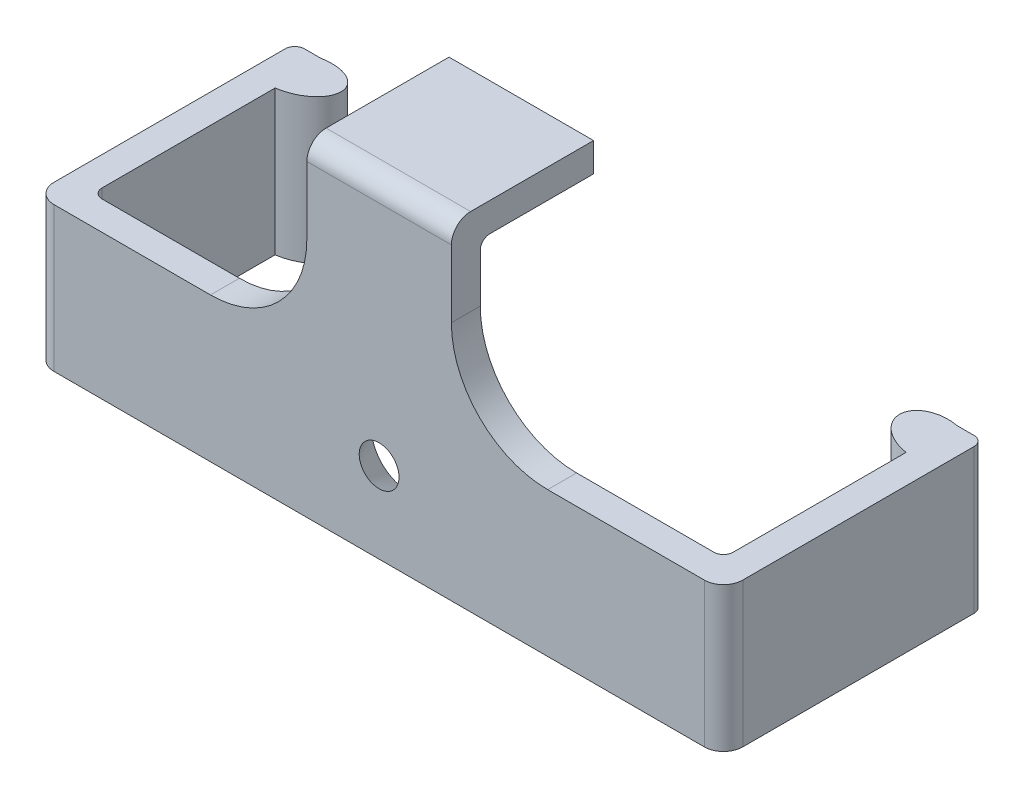
from build123d import *

# Parameters (mm, degrees)
EXTRUDE_1_DEPTH      = 15
EXTRUDE_3_DEPTH      = 7.5
EXTRUDE_3_DEPTH_BACK = 7.5
FILLET_2_R           = 10


with BuildPart() as part:
    # Sketch 190 → Бобышка-Вытянуть1 (new body)
    with BuildSketch(Plane(origin=(0, 0, 0), x_dir=(1, 0, 0), z_dir=(0, 1, 0))):
        with BuildLine():
            Line((31.75, -7), (-31.75, -7))
            ThreePointArc((-31.75, -7), (-32.457106781, -6.707106781), (-32.75, -6))
            Line((-32.75, -6), (-32.75, 11.955044325))
            add(Edge.make_bspline(
                [(-32.75, 11.955044325), (-28.849322717, 12.510434381), (-28.989218264, 15.126744683), (-29.129113811, 17.743054984), (-33.019756548, 17)],
                knots=[4.547577066, 4.547577066, 4.547577066, 6.15424551, 6.15424551, 7.760913955, 7.760913955, 7.760913955], degree=2, weights=[1, 0.694311016, 1, 0.694311016, 1]))
            Line((-33.019756548, 17), (-33.75, 17))
            Line((-33.75, 17), (-34.75, 17))
            ThreePointArc((-34.75, 17), (-35.457106781, 16.707106781), (-35.75, 16))
            Line((-35.75, 16), (-35.75, 12))
            Line((-35.75, 12), (-35.75, -8))
            ThreePointArc((-35.75, -8), (-35.164213562, -9.414213562), (-33.75, -10))
            Line((-33.75, -10), (-32.5, -10))
            Line((-32.5, -10), (32.5, -10))
            Line((32.5, -10), (33.75, -10))
            ThreePointArc((33.75, -10), (35.164213562, -9.414213562), (35.75, -8))
            Line((35.75, -8), (35.75, 12))
            Line((35.75, 12), (35.75, 16))
            ThreePointArc((35.75, 16), (35.457106781, 16.707106781), (34.75, 17))
            Line((34.75, 17), (33.75, 17))
            Line((33.75, 17), (33.019756548, 17))
            add(Edge.make_bspline(
                [(33.019756548, 17), (29.129113811, 17.743054984), (28.989218264, 15.126744683), (28.849322717, 12.510434381), (32.75, 11.955044325)],
                knots=[4.805456659, 4.805456659, 4.805456659, 6.412125104, 6.412125104, 8.018793548, 8.018793548, 8.018793548], degree=2, weights=[1, 0.694311016, 1, 0.694311016, 1]))
            Line((32.75, 11.955044325), (32.75, -6))
            ThreePointArc((32.75, -6), (32.457106781, -6.707106781), (31.75, -7))
        make_face()
    extrude(amount=EXTRUDE_1_DEPTH)

    # Sketch 877 → Бобышка-Вытянуть3 (add, two sides: drawn at the far end of the back side and taken through both)
    with BuildSketch(Plane.ZY.offset(-EXTRUDE_3_DEPTH_BACK)):
        with BuildLine():
            Line((7, 30), (7, 0))
            Line((7, 0), (10, 0))
            Line((10, 0), (10, 31))
            Line((10, 31), (10, 32))
            ThreePointArc((10, 32), (9.414213562, 33.414213562), (8, 34))
            Line((8, 34), (-4.758498288, 34))
            Line((-4.758498288, 34), (-4.758498288, 31))
            Line((-4.758498288, 31), (6, 31))
            ThreePointArc((6, 31), (6.707106781, 30.707106781), (7, 30))
        make_face()
    extrude(amount=EXTRUDE_3_DEPTH + EXTRUDE_3_DEPTH_BACK)

    # Вырез-Вытянуть1 cone 1 section (through the dimple's axis) → Вырез-Вытянуть1 (revolve, cut)
    with BuildSketch(Plane(origin=(0, 8.397050081, 7), x_dir=(0, 1, 0), z_dir=(1, 0, 0))):
        Polygon((0, 0), (3.8, 0), (0, 6.581793069), align=None)
    revolve(axis=Axis((0, 8.397050081, 7), (0, 0, 1)), mode=Mode.SUBTRACT)

    # Скругление2
    fillet_2_edges = [part.edges().sort_by_distance(p)[0] for p in [
        (7.5, 15, 8.5),
        (-7.5, 15, 8.5),
    ]]
    fillet(fillet_2_edges, radius=FILLET_2_R)


solid = part.part
